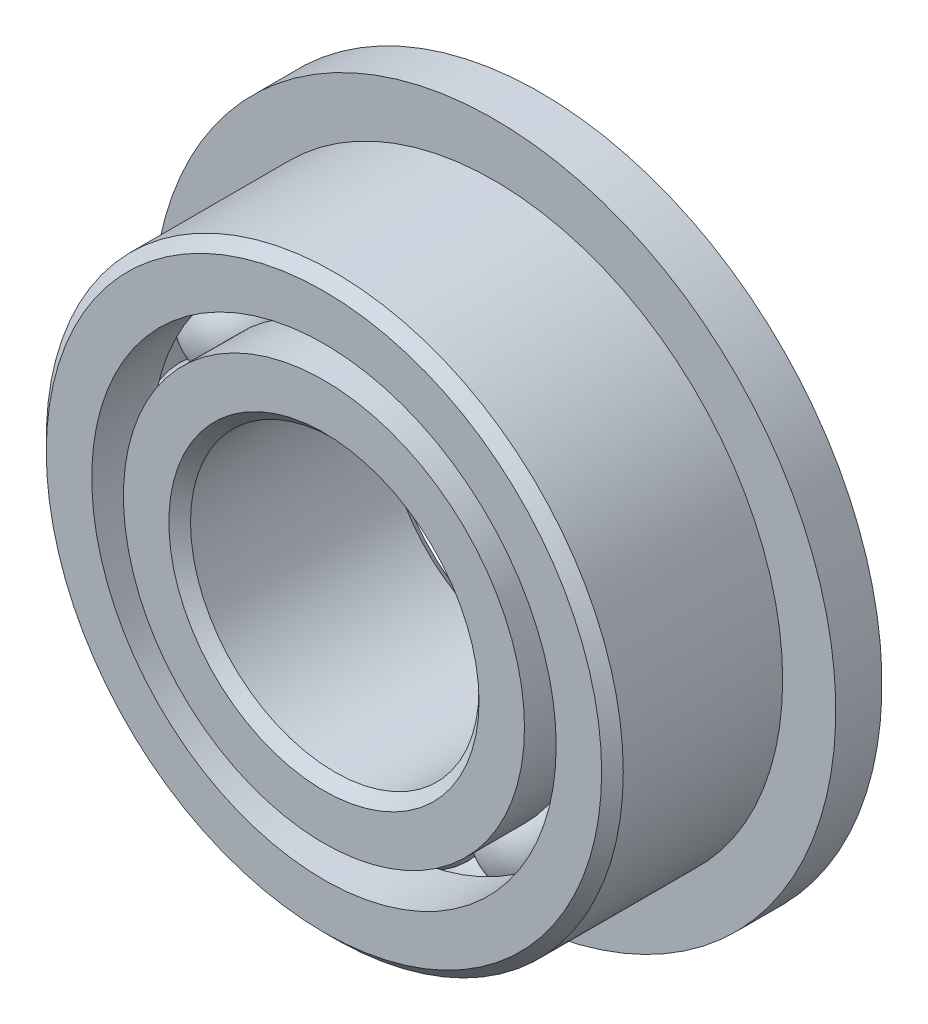
from build123d import *

# Parameters (mm, degrees)
SKETCH5_W         = 0.508
SKETCH5_H         = 0.953380975
CIRPATTERN1_COUNT = 12


with BuildPart() as part:
    # Sketch1 → Revolve1 (revolve)
    with BuildSketch(Plane(origin=(0, 0, 0), x_dir=(0, 0, -1), z_dir=(1, 0, 0)), mode=Mode.PRIVATE) as revolve1_sk:
        with BuildLine():
            Line((1.0715625, 3.175), (-1.0715625, 3.175))
            Line((-1.0715625, 3.175), (-1.190625, 3.0559375))
            Line((-1.190625, 3.0559375), (-1.190625, 2.555700549))
            Line((-1.190625, 2.555700549), (-0.529166667, 2.555700549))
            ThreePointArc((-0.529166667, 2.555700549), (0, 2.938430721), (0.529166667, 2.555700549))
            Line((0.529166667, 2.555700549), (1.190625, 2.555700549))
            Line((1.190625, 2.555700549), (1.190625, 3.0559375))
            Line((1.190625, 3.0559375), (1.0715625, 3.175))
        make_face()
    revolve(revolve1_sk.sketch.rotate(Axis((0, 0, 1.190625), (0, 0, -1)), 90), axis=Axis((0, 0, 1.190625), (0, 0, -1)))

    # Sketch5 → Revolve5 (revolve)
    with BuildSketch(Plane(origin=(0, 0, 0), x_dir=(0, 0, -1), z_dir=(1, 0, 0)), mode=Mode.PRIVATE) as revolve5_sk:
        with Locations((0.936625, 3.282509513)):
            Rectangle(SKETCH5_W, SKETCH5_H)
    revolve(revolve5_sk.sketch.rotate(Axis((0, 0, -1.190625), (0, 0, 1)), 270), axis=Axis((0, 0, -1.190625), (0, 0, 1)))


with BuildPart() as body_2:
    # Sketch3 → Revolve3 (revolve)
    with BuildSketch(Plane(origin=(0, 0, 0), x_dir=(0, 0, -1), z_dir=(1, 0, 0)), mode=Mode.PRIVATE) as revolve3_sk:
        with BuildLine():
            Line((-0.529166667, 2.206799451), (-1.190625, 2.206799451))
            Line((-1.190625, 2.206799451), (-1.190625, 1.7065625))
            Line((-1.190625, 1.7065625), (-1.0715625, 1.5875))
            Line((-1.0715625, 1.5875), (1.0715625, 1.5875))
            Line((1.0715625, 1.5875), (1.190625, 1.7065625))
            Line((1.190625, 1.7065625), (1.190625, 2.206799451))
            Line((1.190625, 2.206799451), (0.529166667, 2.206799451))
            ThreePointArc((0.529166667, 2.206799451), (0, 1.824069279), (-0.529166667, 2.206799451))
        make_face()
    revolve(revolve3_sk.sketch.rotate(Axis((0, 0, 1.190625), (0, 0, -1)), 90), axis=Axis((0, 0, 1.190625), (0, 0, -1)))


with BuildPart() as body_3:
    # Sketch4 → Revolve4 (revolve)
    with BuildSketch(Plane(origin=(0, 0, 0), x_dir=(0, 0, -1), z_dir=(1, 0, 0))):
        with BuildLine():
            Line((-0.557180721, 2.38125), (0.557180721, 2.38125))
            ThreePointArc((0.557180721, 2.38125), (0, 2.938430721), (-0.557180721, 2.38125))
        make_face()
    revolve(axis=Axis((0, 2.38125, 0.557180721), (0, 0, -1)))


with BuildPart() as cirpattern1_1:
    # CirPattern1: pattern copy
    add(body_3.part.rotate(Axis((0, 0, 0), (0, 0, 1)), 1 * 360 / CIRPATTERN1_COUNT))


with BuildPart() as cirpattern1_2:
    # CirPattern1: pattern copy
    add(body_3.part.rotate(Axis((0, 0, 0), (0, 0, 1)), 2 * 360 / CIRPATTERN1_COUNT))


with BuildPart() as cirpattern1_3:
    # CirPattern1: pattern copy
    add(body_3.part.rotate(Axis((0, 0, 0), (0, 0, 1)), 3 * 360 / CIRPATTERN1_COUNT))


with BuildPart() as cirpattern1_4:
    # CirPattern1: pattern copy
    add(body_3.part.rotate(Axis((0, 0, 0), (0, 0, 1)), 4 * 360 / CIRPATTERN1_COUNT))


with BuildPart() as cirpattern1_5:
    # CirPattern1: pattern copy
    add(body_3.part.rotate(Axis((0, 0, 0), (0, 0, 1)), 5 * 360 / CIRPATTERN1_COUNT))


with BuildPart() as cirpattern1_6:
    # CirPattern1: pattern copy
    add(body_3.part.rotate(Axis((0, 0, 0), (0, 0, 1)), 6 * 360 / CIRPATTERN1_COUNT))


with BuildPart() as cirpattern1_7:
    # CirPattern1: pattern copy
    add(body_3.part.rotate(Axis((0, 0, 0), (0, 0, 1)), 7 * 360 / CIRPATTERN1_COUNT))


with BuildPart() as cirpattern1_8:
    # CirPattern1: pattern copy
    add(body_3.part.rotate(Axis((0, 0, 0), (0, 0, 1)), 8 * 360 / CIRPATTERN1_COUNT))


with BuildPart() as cirpattern1_9:
    # CirPattern1: pattern copy
    add(body_3.part.rotate(Axis((0, 0, 0), (0, 0, 1)), 9 * 360 / CIRPATTERN1_COUNT))


with BuildPart() as cirpattern1_10:
    # CirPattern1: pattern copy
    add(body_3.part.rotate(Axis((0, 0, 0), (0, 0, 1)), 10 * 360 / CIRPATTERN1_COUNT))


with BuildPart() as cirpattern1_11:
    # CirPattern1: pattern copy
    add(body_3.part.rotate(Axis((0, 0, 0), (0, 0, 1)), 11 * 360 / CIRPATTERN1_COUNT))


solid = Compound([part.part, body_2.part, body_3.part, cirpattern1_1.part, cirpattern1_2.part, cirpattern1_3.part, cirpattern1_4.part, cirpattern1_5.part, cirpattern1_6.part, cirpattern1_7.part, cirpattern1_8.part, cirpattern1_9.part, cirpattern1_10.part, cirpattern1_11.part])
